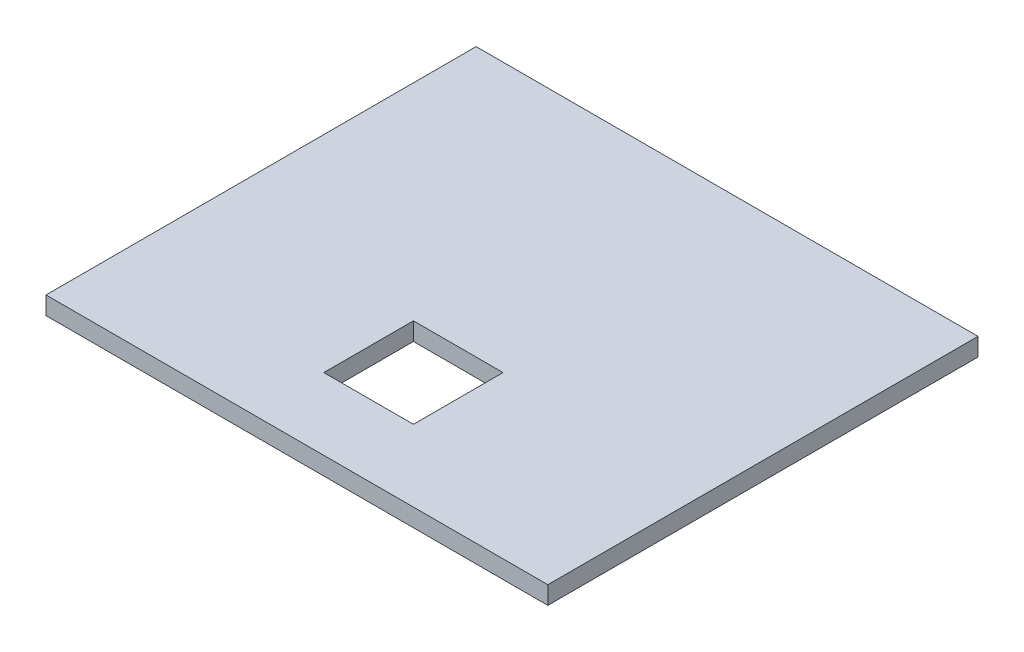
from build123d import *

# Parameters (mm, degrees)
SKETCH1_W           = 177.8
SKETCH1_H           = 152.4
BOSS_EXTRUDE1_DEPTH = 6.35
SKETCH2_W           = 31.75
SKETCH2_H           = 31.75
CUT_EXTRUDE1_DEPTH  = 118.260276735


with BuildPart() as part:
    # Sketch1 → Boss-Extrude1 (new body)
    with BuildSketch(Plane(origin=(0, 0, 0), x_dir=(1, 0, 0), z_dir=(0, 1, 0))):
        Rectangle(SKETCH1_W, SKETCH1_H)
    extrude(amount=BOSS_EXTRUDE1_DEPTH)

    # Sketch2 → Cut-Extrude1 (cut, through all)
    with BuildSketch(Plane(origin=(0, 6.35, 0), x_dir=(1, 0, 0), z_dir=(0, 1, 0))):
        with Locations((0, -34.925)):
            Rectangle(SKETCH2_W, SKETCH2_H)
    extrude(amount=-CUT_EXTRUDE1_DEPTH, mode=Mode.SUBTRACT)


solid = part.part
